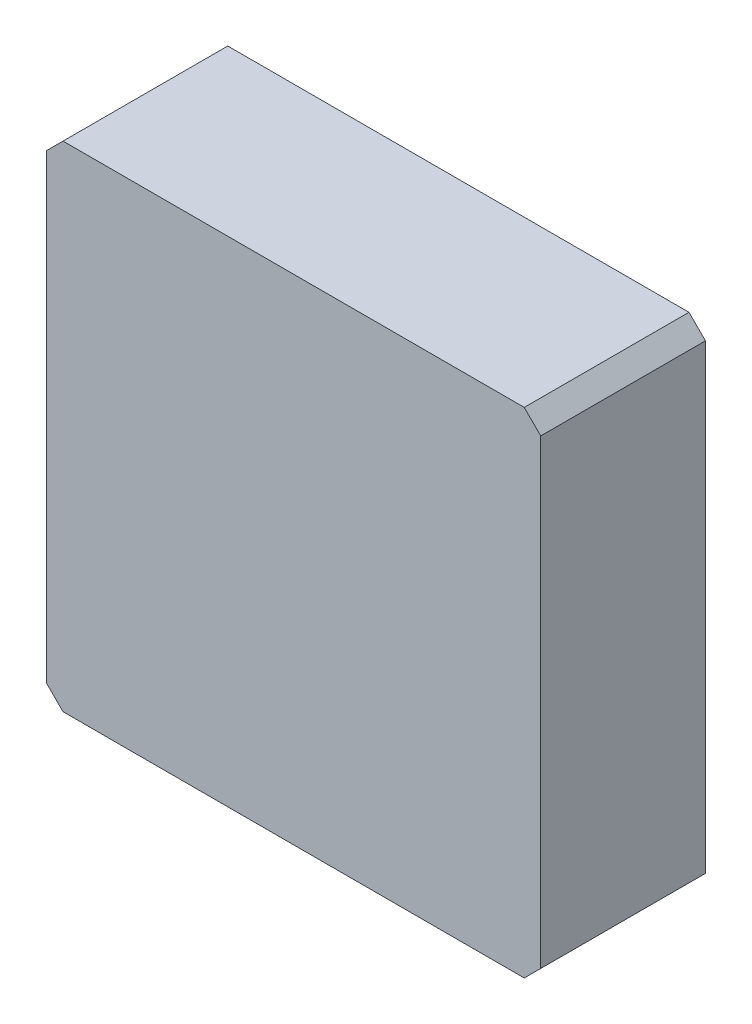
from build123d import *

# Parameters (mm, degrees)
EXTRUDE_1_DEPTH = 10


with BuildPart() as part:
    # 草图1 → 凸台-拉伸1 (new body)
    with BuildSketch(Plane(origin=(0, 0, -5), x_dir=(-1, 0, 0), z_dir=(0, 0, -1))):
        Polygon((-15, -14.000000005), (-14.000000005, -15), (14.000000002, -15), (15, -14.000000002), (15, 14.000000002), (14.000000002, 15), (-14, 15), (-15, 14), align=None)
    extrude(amount=-EXTRUDE_1_DEPTH)


solid = part.part
